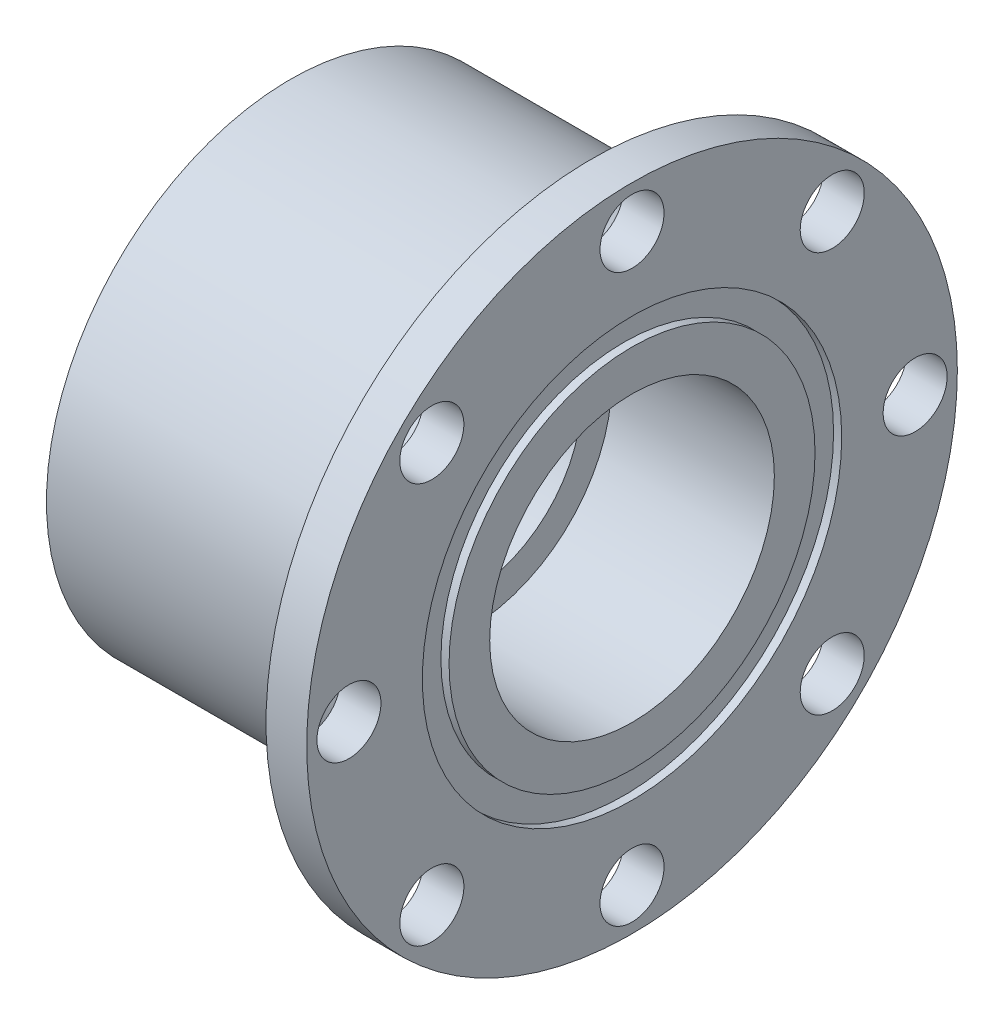
from build123d import *

# Parameters (mm, degrees)
SKETCH1_R                 = 38.1
MAIN_BODY_DEPTH           = 27.94
SKETCH2_R                 = 17.5
STATIC_SEAL_HOLE_DEPTH    = 10.25
SHAFT_HOLE_D              = 18
SKETCH14_R                = 38.1
SKETCH14_R_2              = 22.225
ROTATING_SEAL_SPACE_DEPTH = 25.4
FACE_START                = -6.35
SKETCH7_R                 = 50.8
SKETCH7_R_2               = 22.225
FACE_JOINT_DEPTH          = 6.35
SKETCH8_R                 = 20
BEARING_HOLE_DEPTH        = 13
SCREW_HOLES_D             = 10
SKETCH16_R                = 32.7406
SKETCH16_R_2              = 28.575
GASKET_RING_DEPTH         = 1.27


with BuildPart() as part:
    # Sketch1 → main body (new body)
    with BuildSketch(Plane(origin=(0, 0, 0), x_dir=(0, 0, -1), z_dir=(1, 0, 0))):
        Circle(SKETCH1_R)
    extrude(amount=MAIN_BODY_DEPTH)

    # Sketch2 → Static Seal Hole (cut)
    with BuildSketch(Plane(origin=(27.94, 0, 0), x_dir=(0, 0, -1), z_dir=(1, 0, 0))):
        Circle(SKETCH2_R)
    extrude(amount=-STATIC_SEAL_HOLE_DEPTH, mode=Mode.SUBTRACT)

    # Shaft hole (through all)
    with Locations(Plane(origin=(17.69, 0, 0), x_dir=(0, 0, -1), z_dir=(1, 0, 0))):
        with Locations((0, 0)):
            Hole(SHAFT_HOLE_D / 2)

    # Sketch14 → rotating seal space (add)
    with BuildSketch(Plane(origin=(27.94, 0, 0), x_dir=(0, 0, -1), z_dir=(1, 0, 0))):
        Circle(SKETCH14_R)
        Circle(SKETCH14_R_2, mode=Mode.SUBTRACT)
    extrude(amount=ROTATING_SEAL_SPACE_DEPTH)

    # Sketch7 → face joint (add)
    with BuildSketch(Plane(origin=(53.34, 0, 0), x_dir=(0, 0, -1), z_dir=(1, 0, 0)).offset(FACE_START)):
        Circle(SKETCH7_R)
        Circle(SKETCH7_R_2, mode=Mode.SUBTRACT)
    extrude(amount=FACE_JOINT_DEPTH)

    # Sketch8 → bearing hole (cut)
    with BuildSketch(Plane.ZY):
        Circle(SKETCH8_R)
    extrude(amount=-BEARING_HOLE_DEPTH, mode=Mode.SUBTRACT)

    # Screw holes (through all)
    with Locations(Plane.ZY.offset(-46.99)):
        with Locations((-44.206688043, 0), (-31.258848889, 31.258848889), (0, 44.206688043), (31.258848889, 31.258848889), (44.206688043, 0), (31.258848889, -31.258848889), (0, -44.206688043), (-31.258848889, -31.258848889), (0, 0)):
            Hole(SCREW_HOLES_D / 2)

    # Sketch16 → Gasket ring (cut)
    with BuildSketch(Plane(origin=(53.34, 0, 0), x_dir=(0, 0, -1), z_dir=(1, 0, 0))):
        Circle(SKETCH16_R)
        Circle(SKETCH16_R_2, mode=Mode.SUBTRACT)
    extrude(amount=-GASKET_RING_DEPTH, mode=Mode.SUBTRACT)


solid = part.part
